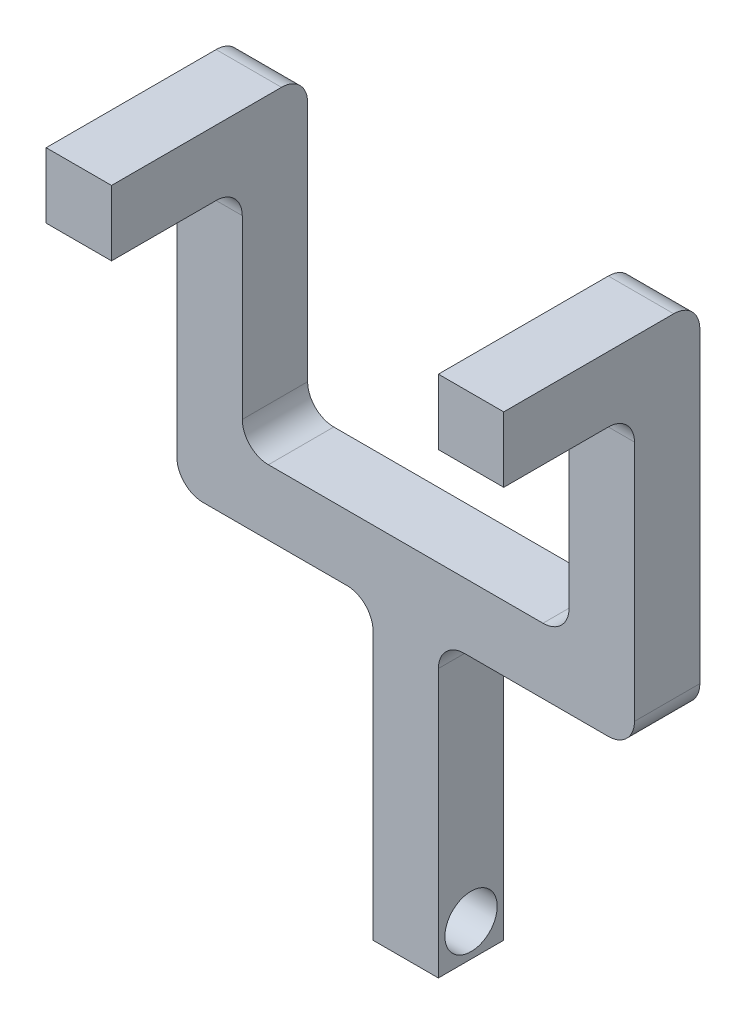
from build123d import *

# Parameters (mm, degrees)
BOSS_EXTRU_1_DEPTH                = 10
ESQUISSE2_W                       = 10
ESQUISSE2_H                       = 10
BOSS_EXTRU_2_DEPTH                = 20
DIAM_TRE_DU_PER_AGE_8_0_8_1_D     = 8
DIAM_TRE_DU_PER_AGE_8_0_8_1_DEPTH = 10
DIAM_TRE_DU_PER_AGE_8_0_8_1_TIP   = 2.403442476
CONG_1_R                          = 4


with BuildPart() as part:
    # Esquisse1 → Boss.-Extru.1 (new body)
    with BuildSketch(Plane.XY):
        Polygon((30, 0), (30, 45), (0, 45), (0, 100), (10, 100), (10, 55), (60, 55), (60, 100), (70, 100), (70, 45), (40, 45), (40, 0), align=None)
    extrude(amount=BOSS_EXTRU_1_DEPTH)

    # Esquisse2 → Boss.-Extru.2 (add)
    with BuildSketch(Plane.XY.offset(10)):
        with Locations((5, 95)):
            Rectangle(ESQUISSE2_W, ESQUISSE2_H)
        with Locations((65, 95)):
            Rectangle(ESQUISSE2_W, ESQUISSE2_H)
    extrude(amount=BOSS_EXTRU_2_DEPTH)

    # Diamètre du perçage Ø8.0 (8)1
    with Locations(Plane.ZY.offset(-30)):
        with Locations((5, 5)):
            Hole(DIAM_TRE_DU_PER_AGE_8_0_8_1_D / 2, depth=DIAM_TRE_DU_PER_AGE_8_0_8_1_DEPTH)
            with Locations((0, 0, -(DIAM_TRE_DU_PER_AGE_8_0_8_1_DEPTH + DIAM_TRE_DU_PER_AGE_8_0_8_1_TIP / 2))):  # 118° drill point
                Cone(0, DIAM_TRE_DU_PER_AGE_8_0_8_1_D / 2, DIAM_TRE_DU_PER_AGE_8_0_8_1_TIP, mode=Mode.SUBTRACT)

    # Congé1
    cong_1_edges = [part.edges().sort_by_distance(p)[0] for p in [
        (5, 100, 0),
        (65, 100, 0),
        (70, 45, 5),
        (40, 45, 5),
        (30, 45, 5),
        (0, 45, 5),
        (10, 55, 5),
        (60, 55, 5),
        (5, 90, 10),
        (65, 90, 10),
    ]]
    fillet(cong_1_edges, radius=CONG_1_R)


solid = part.part
